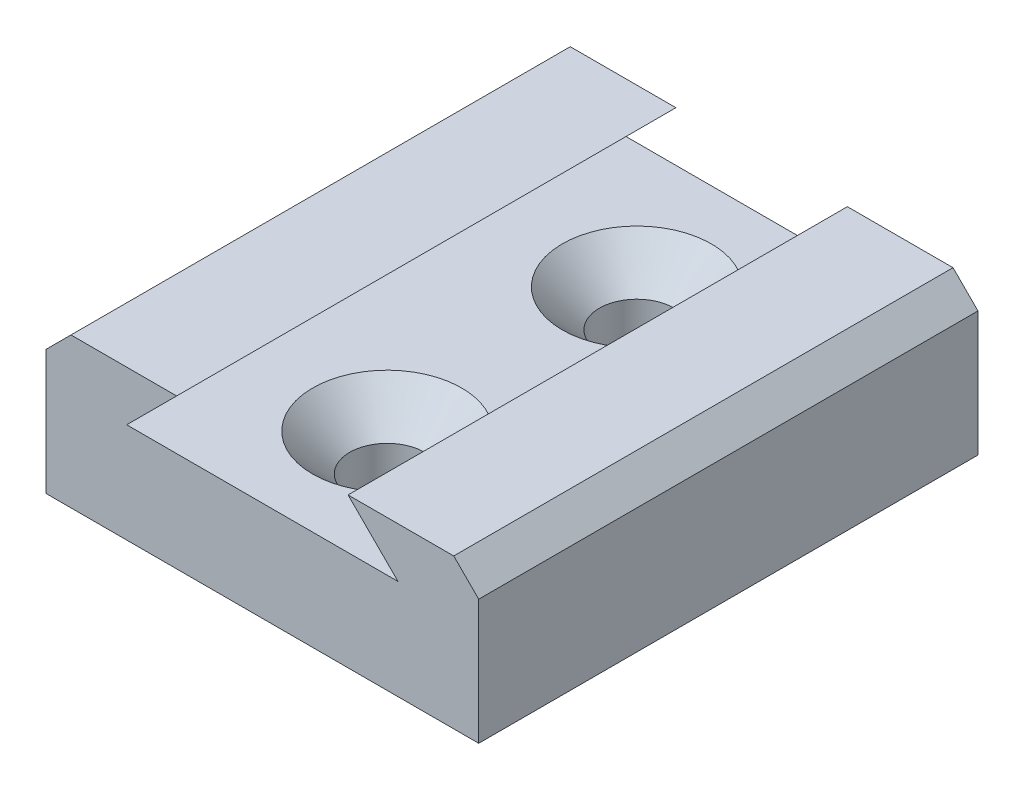
from build123d import *

# Parameters (mm, degrees)
BOSS_EXTRUDE1_DEPTH                                  = 30
CSK_FOR_M4_HEX_SOCKET_COUNTERSUNK_CAP_SC_D           = 4.5
CSK_FOR_M4_HEX_SOCKET_COUNTERSUNK_CAP_SC_CSINK_D     = 8.96
CSK_FOR_M4_HEX_SOCKET_COUNTERSUNK_CAP_SC_CSINK_ANGLE = 90


with BuildPart() as part:
    # Sketch2 → Boss-Extrude1 (new body)
    with BuildSketch(Plane.XY):
        Polygon((-13, 0), (13, 0), (13, 7.5), (11.5, 9), (5.15, 9), (8.15, 6), (-8.15, 6), (-5.15, 9), (-11.5, 9), (-13, 7.5), align=None)
    extrude(amount=BOSS_EXTRUDE1_DEPTH)

    # CSK for M4 Hex Socket Countersunk Cap Screw1 (through all)
    with Locations(Plane(origin=(0, 6, 0), x_dir=(1, 0, 0), z_dir=(0, 1, 0))):
        with Locations((0, -22.5), (0, -7.5)):
            CounterSinkHole(CSK_FOR_M4_HEX_SOCKET_COUNTERSUNK_CAP_SC_D / 2, CSK_FOR_M4_HEX_SOCKET_COUNTERSUNK_CAP_SC_CSINK_D / 2, counter_sink_angle=CSK_FOR_M4_HEX_SOCKET_COUNTERSUNK_CAP_SC_CSINK_ANGLE)


solid = part.part
